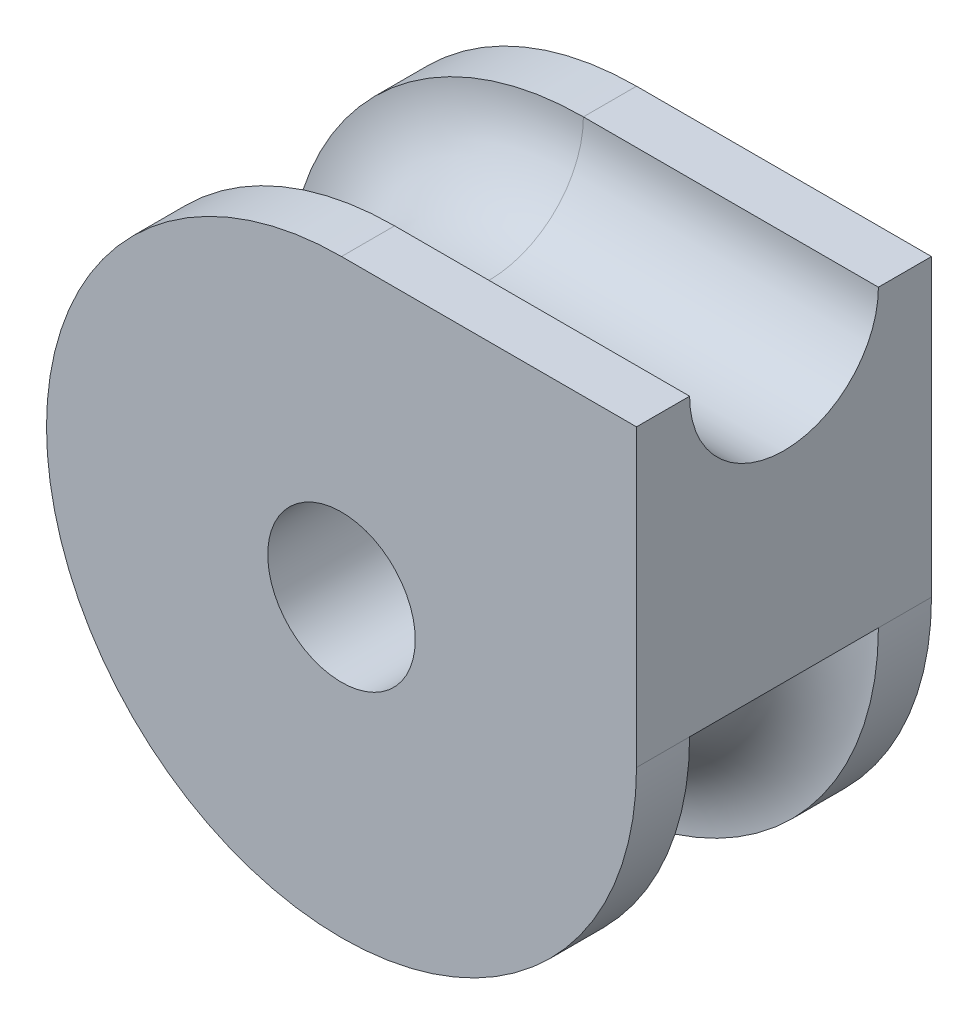
from build123d import *

# Parameters (mm, degrees)
SKETCH1_R           = 12.5
BOSS_EXTRUDE2_DEPTH = 50
CUT_REVOLVE1_ANGLE  = 270
CUT_EXTRUDE1_DEPTH  = 50


with BuildPart() as part:
    # Sketch1 → Boss-Extrude2 (new body)
    with BuildSketch(Plane.XY):
        with BuildLine():
            Line((0, 50), (50, 50))
            Line((50, 50), (50, 0))
            ThreePointArc((50, 0), (-35.355339059, -35.355339059), (0, 50))
        make_face()
        Circle(SKETCH1_R, mode=Mode.SUBTRACT)
    extrude(amount=BOSS_EXTRUDE2_DEPTH)

    # Sketch2 → Cut-Revolve1 (revolve, cut)
    with BuildSketch(Plane(origin=(0, 0, 0), x_dir=(0, 0, -1), z_dir=(1, 0, 0))):
        with BuildLine():
            Line((-41, 50), (-9, 50))
            ThreePointArc((-9, 50), (-25, 34), (-41, 50))
        make_face()
    revolve(axis=Axis((0, 0, 0), (0, 0, 1)), revolution_arc=CUT_REVOLVE1_ANGLE, mode=Mode.SUBTRACT)

    # Sketch2<2> → Cut-Extrude1 (cut)
    with BuildSketch(Plane(origin=(0, 0, 0), x_dir=(0, 0, -1), z_dir=(1, 0, 0))):
        with BuildLine():
            Line((-41, 50), (-9, 50))
            ThreePointArc((-9, 50), (-25, 34), (-41, 50))
        make_face()
    extrude(amount=CUT_EXTRUDE1_DEPTH, mode=Mode.SUBTRACT)


solid = part.part
